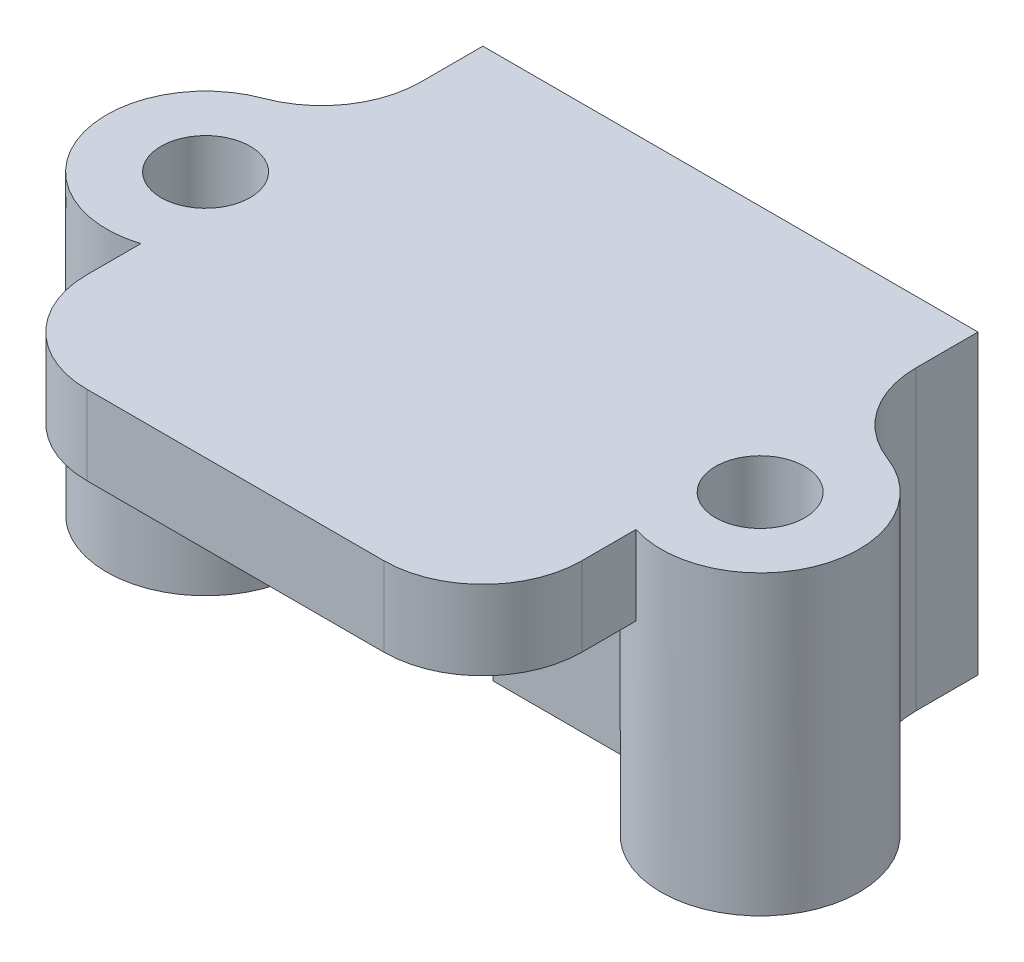
from build123d import *

# Parameters (mm, degrees)
SKETCH6_W           = 25
SKETCH6_H           = 25
BOSS_EXTRUDE3_DEPTH = 4
SKETCH11_R          = 5
BOSS_EXTRUDE7_DEPTH = 15
SKETCH8_W           = 25
SKETCH8_H           = 12.5
BOSS_EXTRUDE5_DEPTH = 11
SKETCH12_R          = 2.25
CUT_EXTRUDE3_DEPTH  = 28.244265452
SKETCH9_W           = 1
SKETCH9_H           = 7
CUT_EXTRUDE2_DEPTH  = 11
CUT_EXTRUDE4_DEPTH  = 1.5
FILLET2_R           = 5


with BuildPart() as part:
    # Sketch6 → Boss-Extrude3 (new body)
    with BuildSketch(Plane.XZ):
        Rectangle(SKETCH6_W, SKETCH6_H)
    extrude(amount=BOSS_EXTRUDE3_DEPTH)

    # Sketch11 → Boss-Extrude7 (add)
    with BuildSketch(Plane(origin=(0, 0, 0), x_dir=(1, 0, 0), z_dir=(0, 1, 0))):
        with Locations(Location((-14, 0, 0), (0, 0, 270))):
            Circle(SKETCH11_R)
        with Locations(Location((14, 0, 0), (0, 0, 270))):
            Circle(SKETCH11_R)
    extrude(amount=-BOSS_EXTRUDE7_DEPTH)

    # Sketch8 → Boss-Extrude5 (add)
    with BuildSketch(Plane.XZ.offset(4)):
        with Locations((0, -6.25)):
            Rectangle(SKETCH8_W, SKETCH8_H)
    extrude(amount=BOSS_EXTRUDE5_DEPTH)

    # Sketch12 → Cut-Extrude3 (cut, through all)
    with BuildSketch(Plane(origin=(0, 0, 0), x_dir=(1, 0, 0), z_dir=(0, 1, 0))):
        with Locations(Location((-14, 0, 0), (0, 0, 270))):
            Circle(SKETCH12_R)
        with Locations(Location((14, 0, 0), (0, 0, 270))):
            Circle(SKETCH12_R)
    extrude(amount=-CUT_EXTRUDE3_DEPTH, mode=Mode.SUBTRACT)

    # Sketch9 → Cut-Extrude2 (cut)
    with BuildSketch(Plane.XZ.offset(15)):
        with Locations((0, -3.5)):
            Rectangle(SKETCH9_W, SKETCH9_H)
    extrude(amount=-CUT_EXTRUDE2_DEPTH, mode=Mode.SUBTRACT)

    # Sketch13 → Cut-Extrude4 (cut)
    with BuildSketch(Plane.XZ.offset(4)):
        with BuildLine():
            Line((-11, 0), (-11, 12.5))
            Line((-11, 12.5), (11, 12.5))
            Line((11, 12.5), (11, 0))
            ThreePointArc((11, 0), (0, -11), (-11, 0))
        make_face()
    extrude(amount=CUT_EXTRUDE4_DEPTH, mode=Mode.SUBTRACT)

    # Fillet2
    fillet2_edges = [part.edges().sort_by_distance(p)[0] for p in [
        (-12.5, -7.5, -4.769696007),
        (12.5, -7.5, -4.769696007),
        (-12.5, -2, 12.5),
        (12.5, -2, 12.5),
    ]]
    fillet(fillet2_edges, radius=FILLET2_R)


solid = part.part
